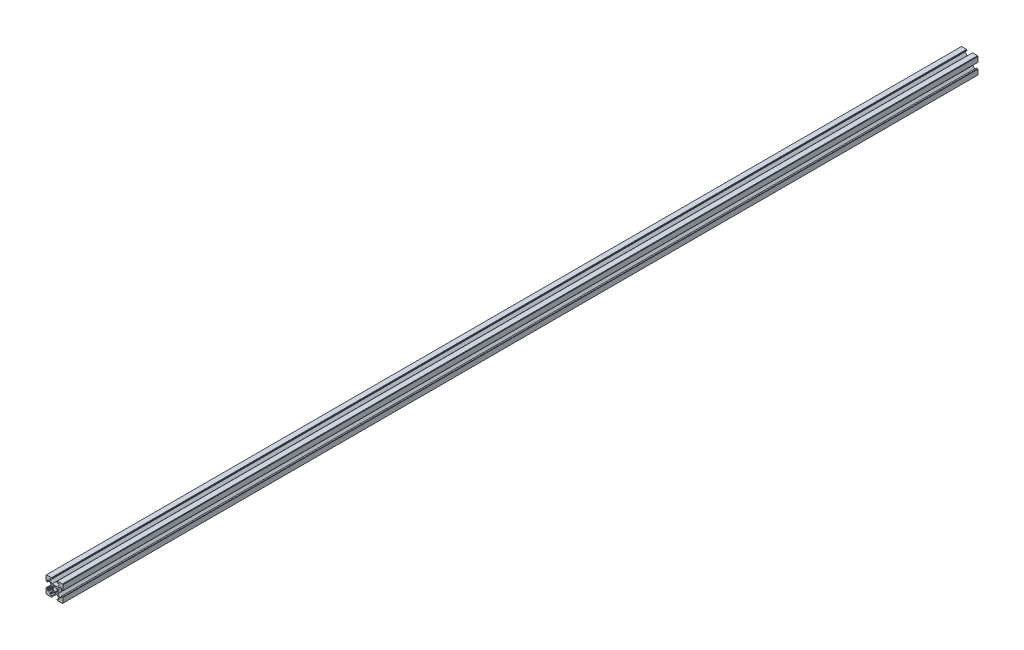
from build123d import *

# Parameters (mm, degrees)
BOSS_EXTRUDE1_DEPTH             = 1082
M6X1_0_TAPPED_HOLE2_D           = 5
M6X1_0_TAPPED_HOLE2_DEPTH       = 28.497848452
M6X1_0_TAPPED_HOLE2_CSINK_D     = 6.05
M6X1_0_TAPPED_HOLE2_CSINK_ANGLE = 90
M6X1_0_TAPPED_HOLE2_TIP         = 1.502151548


with BuildPart() as part:
    # Sketch1 → Boss-Extrude1 (new body)
    with BuildSketch(Plane.XY):
        with BuildLine():
            Line((-9.5, 10), (-3.486470896, 10))
            ThreePointArc((-3.486470896, 10), (-3.373276191, 9.726723809), (-3.1, 9.613529104))
            Line((-3.1, 9.613529104), (-3.1, 8.7))
            Line((-3.1, 8.7), (-3.6, 8.2))
            Line((-3.6, 8.2), (-5, 8.2))
            Line((-5, 8.2), (-5.5, 7.7))
            Line((-5.5, 7.7), (-5.5, 6.560660172))
            Line((-5.5, 6.560660172), (-2.839339828, 3.9))
            Line((-2.839339828, 3.9), (0, 3.9))
            Line((0, 3.9), (2.839339828, 3.9))
            Line((2.839339828, 3.9), (5.5, 6.560660172))
            Line((5.5, 6.560660172), (5.5, 7.7))
            Line((5.5, 7.7), (5, 8.2))
            Line((5, 8.2), (3.1, 8.2))
            Line((3.1, 8.2), (3.1, 9.613529104))
            ThreePointArc((3.1, 9.613529104), (3.373276191, 9.726723809), (3.486470896, 10))
            Line((3.486470896, 10), (9.5, 10))
            Line((9.5, 10), (10, 9.5))
            Line((10, 9.5), (10, 3.486470896))
            ThreePointArc((10, 3.486470896), (9.726723809, 3.373276191), (9.613529104, 3.1))
            Line((9.613529104, 3.1), (8.7, 3.1))
            Line((8.7, 3.1), (8.2, 3.6))
            Line((8.2, 3.6), (8.2, 5))
            Line((8.2, 5), (7.7, 5.5))
            Line((7.7, 5.5), (6.560660172, 5.5))
            Line((6.560660172, 5.5), (3.9, 2.839339828))
            Line((3.9, 2.839339828), (3.9, 0))
            Line((3.9, 0), (3.9, -2.839339828))
            Line((3.9, -2.839339828), (6.560660172, -5.5))
            Line((6.560660172, -5.5), (7.7, -5.5))
            Line((7.7, -5.5), (8.2, -5))
            Line((8.2, -5), (8.2, -3.1))
            Line((8.2, -3.1), (9.613529104, -3.1))
            ThreePointArc((9.613529104, -3.1), (9.726723809, -3.373276191), (10, -3.486470896))
            Line((10, -3.486470896), (10, -9.5))
            Line((10, -9.5), (9.5, -10))
            Line((9.5, -10), (3.486470896, -10))
            ThreePointArc((3.486470896, -10), (3.373276191, -9.726723809), (3.1, -9.613529104))
            Line((3.1, -9.613529104), (3.1, -8.7))
            Line((3.1, -8.7), (3.6, -8.2))
            Line((3.6, -8.2), (5, -8.2))
            Line((5, -8.2), (5.5, -7.7))
            Line((5.5, -7.7), (5.5, -6.560660172))
            Line((5.5, -6.560660172), (2.839339828, -3.9))
            Line((2.839339828, -3.9), (0, -3.9))
            Line((0, -3.9), (-2.839339828, -3.9))
            Line((-2.839339828, -3.9), (-5.5, -6.560660172))
            Line((-5.5, -6.560660172), (-5.5, -7.7))
            Line((-5.5, -7.7), (-5, -8.2))
            Line((-5, -8.2), (-3.1, -8.2))
            Line((-3.1, -8.2), (-3.1, -9.613529104))
            ThreePointArc((-3.1, -9.613529104), (-3.373276191, -9.726723809), (-3.486470896, -10))
            Line((-3.486470896, -10), (-9.5, -10))
            Line((-9.5, -10), (-10, -9.5))
            Line((-10, -9.5), (-10, -3.486470896))
            ThreePointArc((-10, -3.486470896), (-9.726723809, -3.373276191), (-9.613529104, -3.1))
            Line((-9.613529104, -3.1), (-8.7, -3.1))
            Line((-8.7, -3.1), (-8.2, -3.6))
            Line((-8.2, -3.6), (-8.2, -5))
            Line((-8.2, -5), (-7.7, -5.5))
            Line((-7.7, -5.5), (-6.560660172, -5.5))
            Line((-6.560660172, -5.5), (-3.9, -2.839339828))
            Line((-3.9, -2.839339828), (-3.9, 0))
            Line((-3.9, 0), (-3.9, 2.839339828))
            Line((-3.9, 2.839339828), (-6.560660172, 5.5))
            Line((-6.560660172, 5.5), (-7.7, 5.5))
            Line((-7.7, 5.5), (-8.2, 5))
            Line((-8.2, 5), (-8.2, 3.1))
            Line((-8.2, 3.1), (-9.613529104, 3.1))
            ThreePointArc((-9.613529104, 3.1), (-9.726723809, 3.373276191), (-10, 3.486470896))
            Line((-10, 3.486470896), (-10, 9.5))
            Line((-10, 9.5), (-9.5, 10))
        make_face()
    extrude(amount=BOSS_EXTRUDE1_DEPTH)

    # Sketch2 → M6x1.0 Tapped Hole1 (revolve, cut)
    with BuildSketch(Plane(origin=(0, 0, 1082), x_dir=(0, -1, 0), z_dir=(1, 0, 0))):
        Polygon((0, 0), (0, 30), (2.5, 28.497848452), (2.5, 0.525), (3.025, 0), align=None)
    revolve(axis=Axis((0, 0, 1088.35), (0, 0, -1)), mode=Mode.SUBTRACT)

    # M6x1.0 Tapped Hole2
    with Locations(Plane(origin=(0, 0, 0), x_dir=(-1, 0, 0), z_dir=(0, 0, -1))):
        with Locations((0, 0)):
            CounterSinkHole(M6X1_0_TAPPED_HOLE2_D / 2, M6X1_0_TAPPED_HOLE2_CSINK_D / 2, depth=M6X1_0_TAPPED_HOLE2_DEPTH, counter_sink_angle=M6X1_0_TAPPED_HOLE2_CSINK_ANGLE)
            with Locations((0, 0, -(M6X1_0_TAPPED_HOLE2_DEPTH + M6X1_0_TAPPED_HOLE2_TIP / 2))):  # 118° drill point
                Cone(0, M6X1_0_TAPPED_HOLE2_D / 2, M6X1_0_TAPPED_HOLE2_TIP, mode=Mode.SUBTRACT)


solid = part.part
